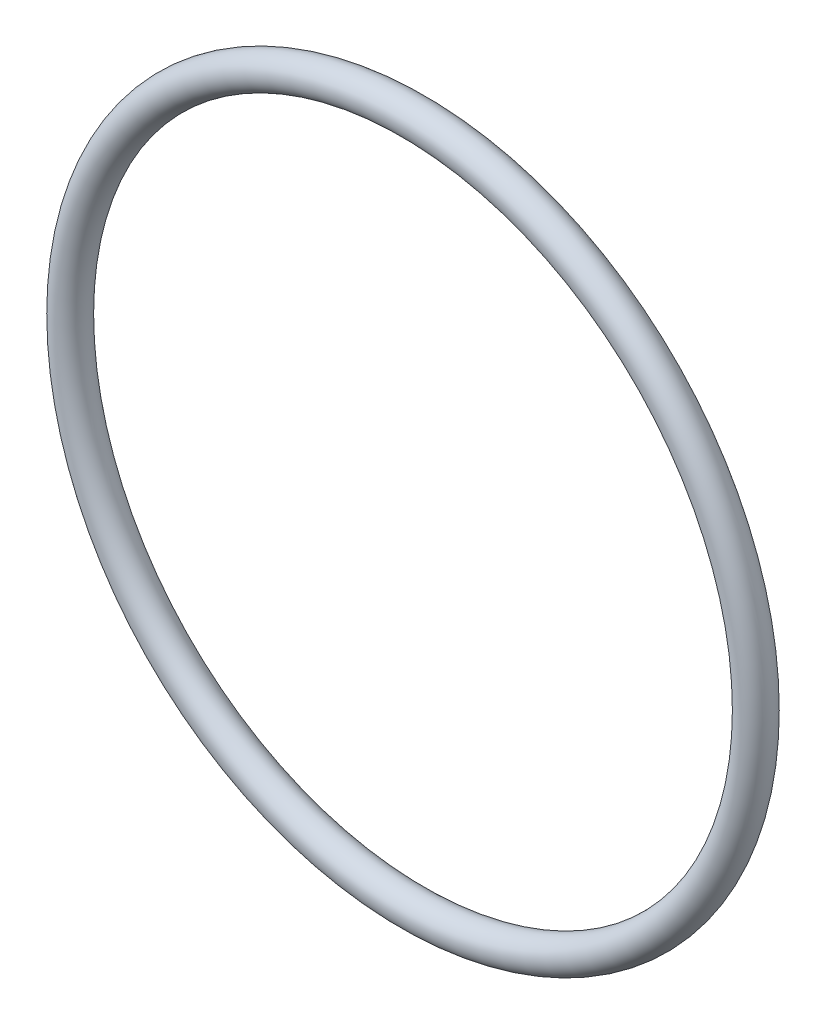
from build123d import *

# Parameters (mm, degrees)
SKETCH1_R = 1.7653


with BuildPart() as part:
    # Sketch1 → Revolve1 (revolve)
    with BuildSketch(Plane(origin=(0, 0, 0), x_dir=(0, -1, 0), z_dir=(1, 0, 0)), mode=Mode.PRIVATE) as revolve1_sk:
        with Locations((36.4871, 0)):
            Circle(SKETCH1_R)
    revolve(revolve1_sk.sketch.rotate(Axis((0, 0, 1.7653), (0, 0, -1)), 270), axis=Axis((0, 0, 1.7653), (0, 0, -1)))


solid = part.part
